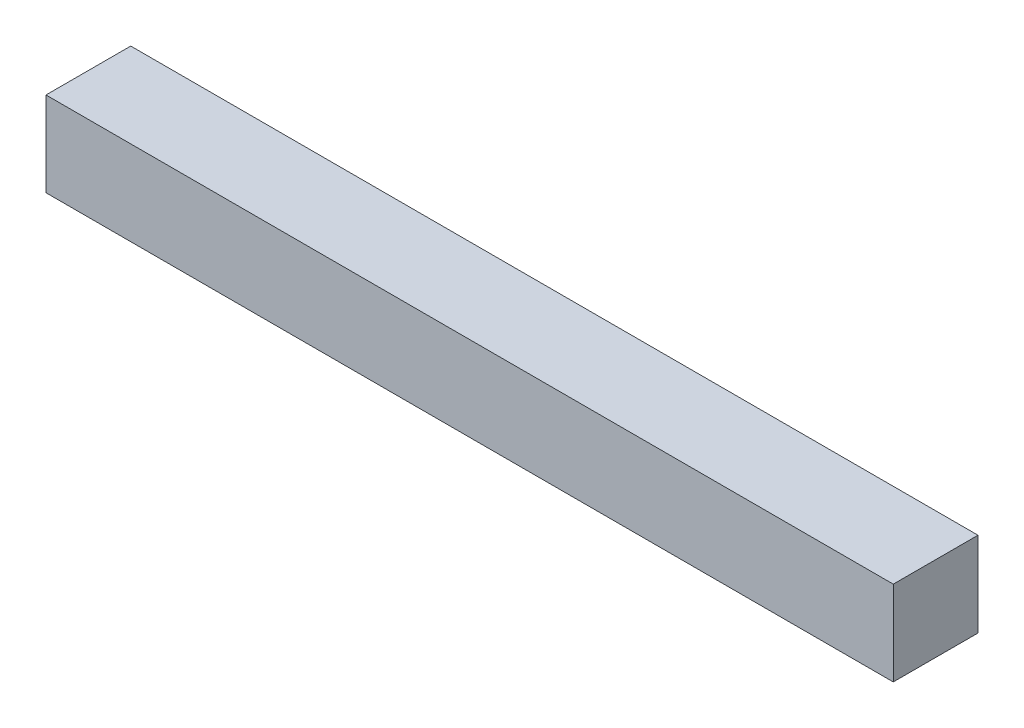
from build123d import *

# Parameters (mm, degrees)
SKETCH2_W      = 10
SKETCH2_H      = 1
EXTRUDE1_DEPTH = 1


with BuildPart() as part:
    # Sketch2 → Extrude1 (new body)
    with BuildSketch(Plane.XY):
        with Locations((5, -2.547711334)):
            Rectangle(SKETCH2_W, SKETCH2_H)
    extrude(amount=EXTRUDE1_DEPTH)


solid = part.part
